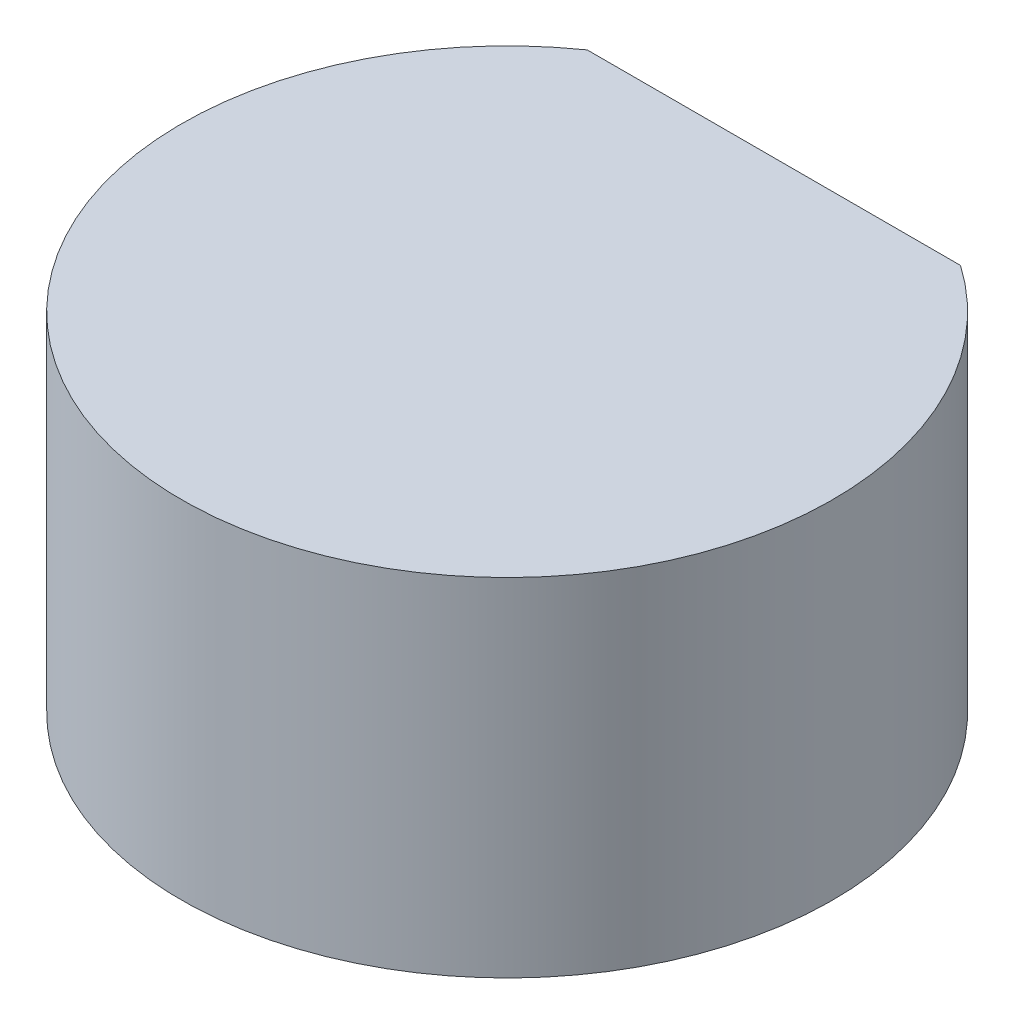
from build123d import *

# Parameters (mm, degrees)
BOSS_EXTRUDE1_DEPTH = 82.55
SKETCH2_R           = 2
CUT_EXTRUDE1_DEPTH  = 5
SKETCH3_W           = 31.5
SKETCH3_H           = 23.5
BOSS_EXTRUDE2_DEPTH = 15


with BuildPart() as part:
    # Sketch1 → Boss-Extrude1 (new body)
    with BuildSketch(Plane(origin=(0, 0, 0), x_dir=(1, 0, 0), z_dir=(0, 1, 0))):
        with BuildLine():
            Line((-44.429719783, 63.5), (44.429719783, 63.5))
            ThreePointArc((44.429719783, 63.5), (0, -77.5), (-44.429719783, 63.5))
        make_face()
    extrude(amount=BOSS_EXTRUDE1_DEPTH)

    # Sketch2 → Cut-Extrude1 (cut)
    with BuildSketch(Plane.XZ):
        with Locations(Location((-27, -27.5, 0), (0, 0, 270))):
            Circle(SKETCH2_R)
        with Locations(Location((-27, 26.5, 0), (0, 0, 270))):
            Circle(SKETCH2_R)
        with Locations(Location((21, 30.5, 0), (0, 0, 270))):
            Circle(SKETCH2_R)
        with Locations(Location((27, -27.5, 0), (0, 0, 90))):
            Circle(SKETCH2_R)
    extrude(amount=-CUT_EXTRUDE1_DEPTH, mode=Mode.SUBTRACT)

    # Sketch3 → Boss-Extrude2 (add)
    with BuildSketch(Plane(origin=(0, 0, -63.5), x_dir=(-1, 0, 0), z_dir=(0, 0, -1))):
        with Locations((8.56875, 30.75)):
            Rectangle(SKETCH3_W, SKETCH3_H)
    extrude(amount=BOSS_EXTRUDE2_DEPTH)


solid = part.part
